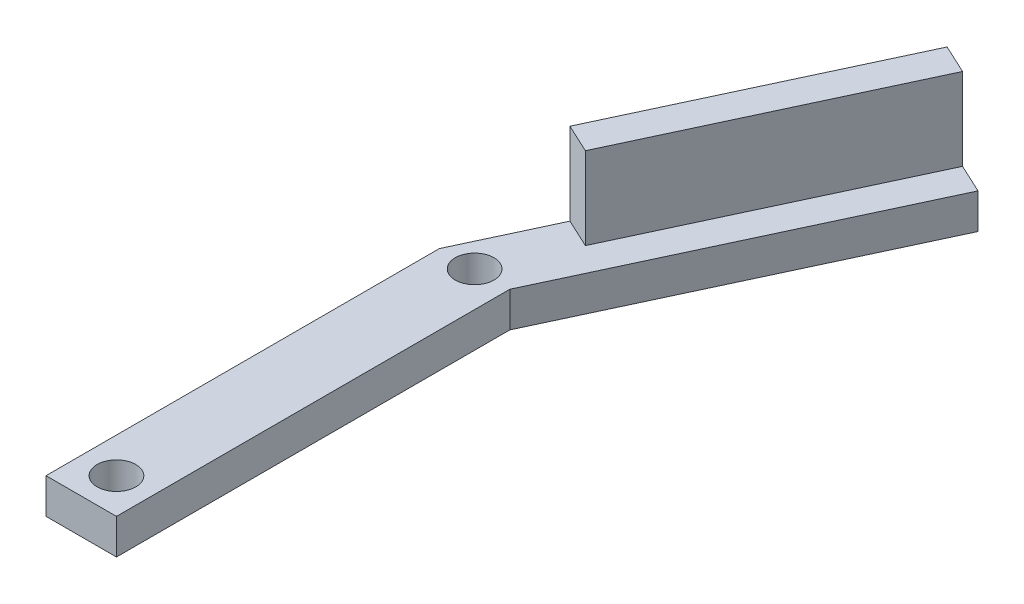
from build123d import *

# Parameters (mm, degrees)
SKETCH1_R           = 1.65
BOSS_EXTRUDE1_DEPTH = 3
BOSS_EXTRUDE2_DEPTH = 10


with BuildPart() as part:
    # Sketch1 → Boss-Extrude1 (new body)
    with BuildSketch(Plane(origin=(0, 0, 0), x_dir=(1, 0, 0), z_dir=(0, 1, 0))):
        Polygon((-3, 30.5), (-3, -3), (3, -3), (3, 30.5), (15.678547852, 57.689233611), (13.214366438, 58.838300276), (3, 36.933520762), (0.535818585, 38.082587426), align=None)
        with Locations((0, 30.5)):
            Circle(SKETCH1_R, mode=Mode.SUBTRACT)
        Circle(SKETCH1_R, mode=Mode.SUBTRACT)
    extrude(amount=BOSS_EXTRUDE1_DEPTH)

    # Sketch1<4> → Boss-Extrude2 (add)
    with BuildSketch(Plane(origin=(0, 0, 0), x_dir=(1, 0, 0), z_dir=(0, 1, 0))):
        Polygon((10.750185023, 59.98736694), (0.535818585, 38.082587426), (3, 36.933520762), (13.214366438, 58.838300276), align=None)
    extrude(amount=BOSS_EXTRUDE2_DEPTH)


solid = part.part
